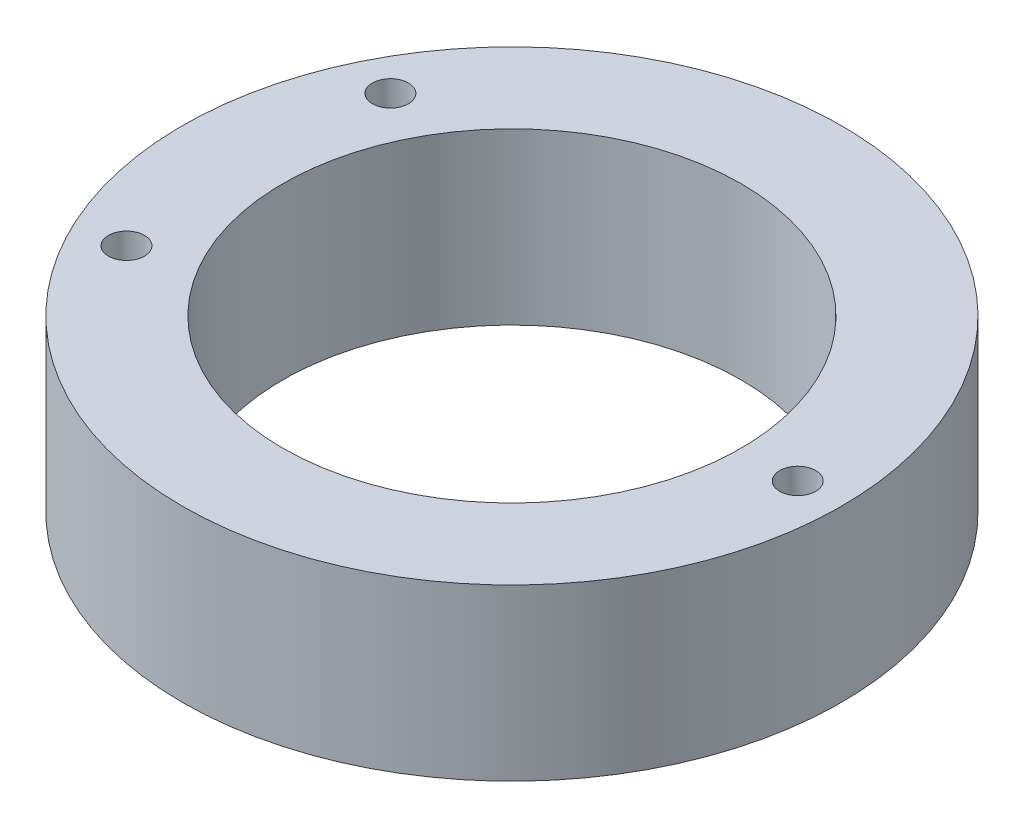
from build123d import *

# Parameters (mm, degrees)
SKETCH_1_R      = 32
SKETCH_1_R_2    = 22.25
SKETCH_1_R_3    = 1.75
EXTRUDE_1_DEPTH = 16.5


with BuildPart() as part:
    # 草图1 → 凸台-拉伸1 (new body)
    with BuildSketch(Plane(origin=(0, 0, 0), x_dir=(1, 0, 0), z_dir=(0, 1, 0))):
        with Locations(Location((0, 0, 0), (0, 0, 270))):
            Circle(SKETCH_1_R)
        with Locations(Location((0, 0, 0), (0, 0, 270))):
            Circle(SKETCH_1_R_2, mode=Mode.SUBTRACT)
        with Locations(Location((27.75, 0, 0), (0, 0, 270))):
            Circle(SKETCH_1_R_3, mode=Mode.SUBTRACT)
        with Locations(Location((-24.614550621, 12.813524017, 0), (0, 0, 270))):
            Circle(SKETCH_1_R_3, mode=Mode.SUBTRACT)
        with Locations(Location((-24.614550621, -12.813524017, 0), (0, 0, 270))):
            Circle(SKETCH_1_R_3, mode=Mode.SUBTRACT)
    extrude(amount=EXTRUDE_1_DEPTH)


solid = part.part
